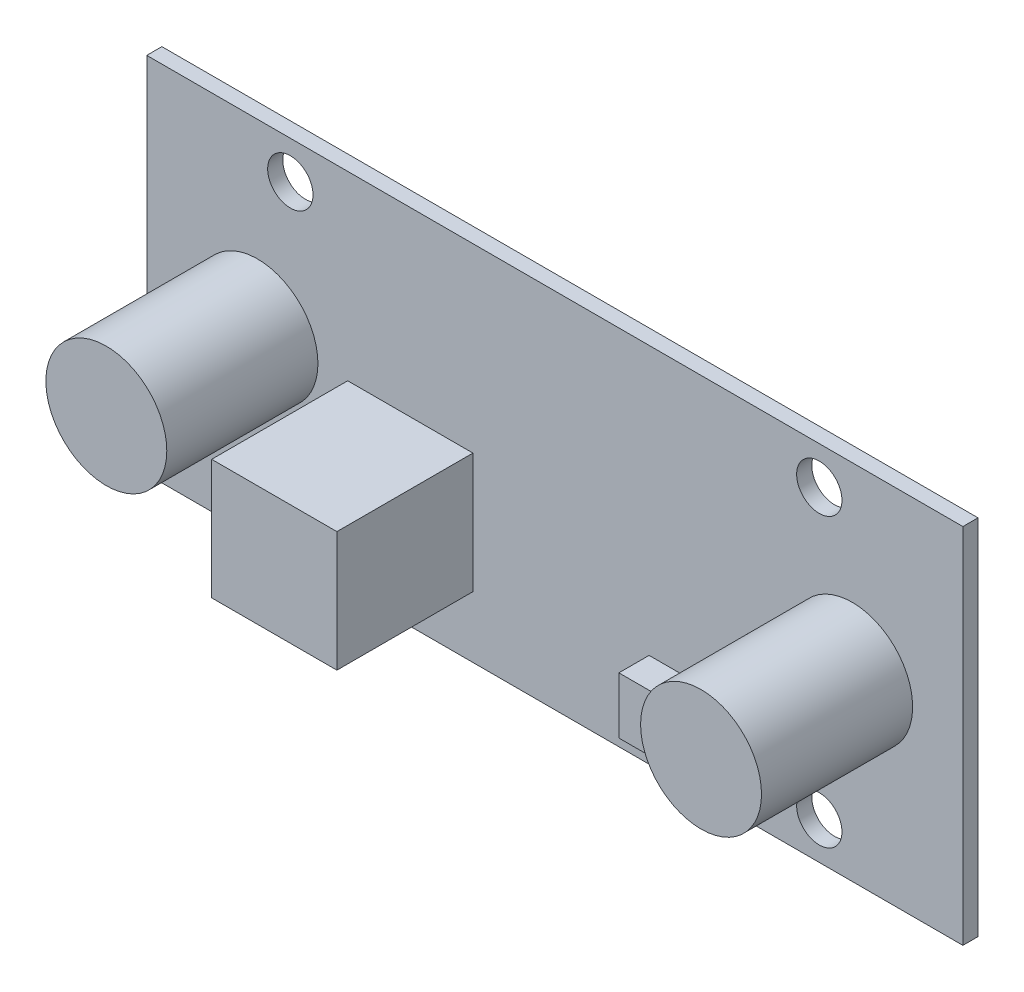
from build123d import *

# Parameters (mm, degrees)
SKETCH1_W           = 54
SKETCH1_H           = 24
SKETCH1_R           = 1.5
SKETCH1_R_2         = 4
SKETCH1_W_2         = 6.671328762
SKETCH1_H_2         = 3.736160039
SKETCH1_W_3         = 8.286492568
SKETCH1_H_3         = 7.940799873
BOSS_EXTRUDE1_DEPTH = 1
SKETCH1_2_R         = 4
BOSS_EXTRUDE2_DEPTH = 11
SKETCH1_3_W         = 8.286492568
SKETCH1_3_H         = 7.940799873
BOSS_EXTRUDE3_DEPTH = 10
SKETCH1_4_W         = 6.671328762
SKETCH1_4_H         = 3.736160039
BOSS_EXTRUDE4_DEPTH = 3


with BuildPart() as part:
    # Sketch1 → Boss-Extrude1 (new body)
    with BuildSketch(Plane.XY):
        with Locations((27, 12)):
            Rectangle(SKETCH1_W, SKETCH1_H)
        with Locations((9.5, 21.5)):
            Circle(SKETCH1_R, mode=Mode.SUBTRACT)
        with Locations((9.5, 2.5)):
            Circle(SKETCH1_R, mode=Mode.SUBTRACT)
        with Locations((44.5, 2.5)):
            Circle(SKETCH1_R, mode=Mode.SUBTRACT)
        with Locations((44.5, 21.5)):
            Circle(SKETCH1_R, mode=Mode.SUBTRACT)
        with Locations((7.325006642, 12)):
            Circle(SKETCH1_R_2, mode=Mode.SUBTRACT)
        with Locations((46.674993358, 12)):
            Circle(SKETCH1_R_2, mode=Mode.SUBTRACT)
        with Locations((36.573516425, 4.36808002)):
            Rectangle(SKETCH1_W_2, SKETCH1_H_2, mode=Mode.SUBTRACT)
        with Locations((17.437336555, 8.029600064)):
            Rectangle(SKETCH1_W_3, SKETCH1_H_3, mode=Mode.SUBTRACT)
    extrude(amount=BOSS_EXTRUDE1_DEPTH)

    # Sketch1<2> → Boss-Extrude2 (add)
    with BuildSketch(Plane.XY):
        with Locations((7.325006642, 12)):
            Circle(SKETCH1_2_R)
        with Locations((46.674993358, 12)):
            Circle(SKETCH1_2_R)
    extrude(amount=BOSS_EXTRUDE2_DEPTH)

    # Sketch1<3> → Boss-Extrude3 (add)
    with BuildSketch(Plane.XY):
        with Locations((17.437336555, 8.029600064)):
            Rectangle(SKETCH1_3_W, SKETCH1_3_H)
    extrude(amount=BOSS_EXTRUDE3_DEPTH)

    # Sketch1<4> → Boss-Extrude4 (add)
    with BuildSketch(Plane.XY):
        with Locations((36.573516425, 4.36808002)):
            Rectangle(SKETCH1_4_W, SKETCH1_4_H)
    extrude(amount=BOSS_EXTRUDE4_DEPTH)


solid = part.part
